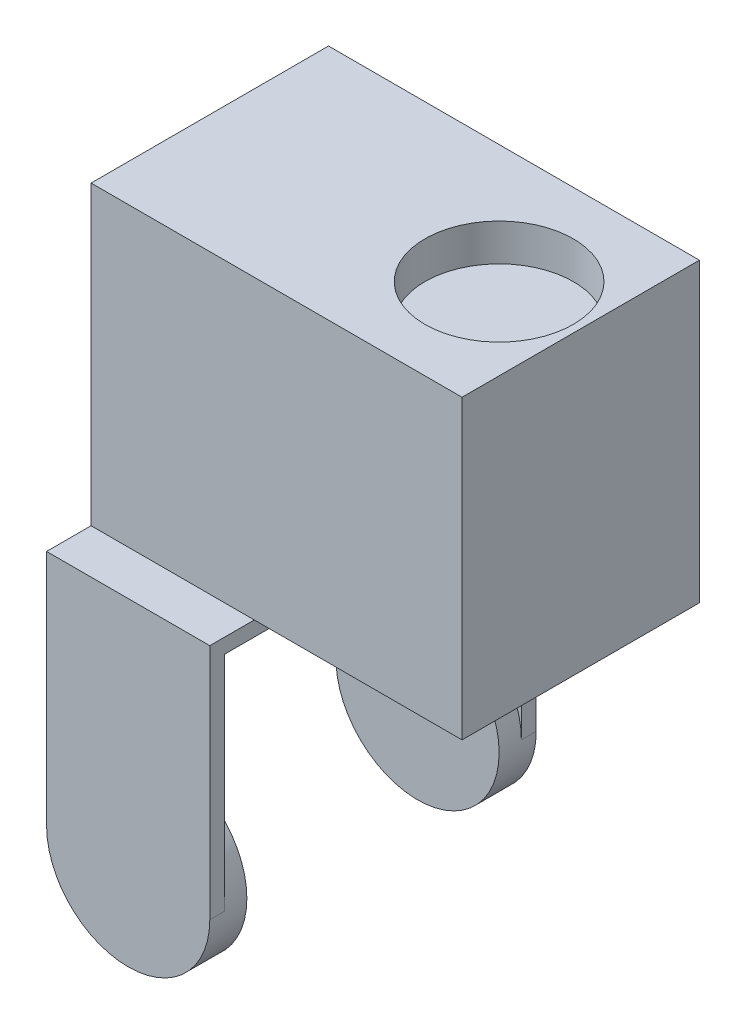
from build123d import *

# Parameters (mm, degrees)
BOSS_EXTRUDE1_DEPTH = 32
BOSS_EXTRUDE2_DEPTH = 38
BOSS_EXTRUDE3_START = 6
BOSS_EXTRUDE3_DEPTH = 6
SKETCH2_W           = 40
SKETCH2_H           = 41
CUT_EXTRUDE1_DEPTH  = 22
SKETCH3_R           = 11
BOSS_EXTRUDE5_DEPTH = 3
BOSS_EXTRUDE6_START = 3
SKETCH4_R           = 11
BOSS_EXTRUDE6_DEPTH = 3
SKETCH13_R          = 10
CUT_EXTRUDE2_DEPTH  = 5


with BuildPart() as part:
    # Sketch1 → Boss-Extrude1 (new body)
    with BuildSketch(Plane.XY):
        Polygon((25, 20), (-25, 20), (-25, -20), (-3, -20), (25, -20), align=None)
    extrude(amount=-BOSS_EXTRUDE1_DEPTH)

    # Sketch1<3> → Boss-Extrude2 (add)
    with BuildSketch(Plane.XY):
        with BuildLine():
            Line((-3, -20), (-25, -20))
            Line((-25, -20), (-25, -52))
            ThreePointArc((-25, -52), (-14, -63), (-3, -52))
            Line((-3, -52), (-3, -20))
        make_face()
    extrude(amount=-BOSS_EXTRUDE2_DEPTH)

    # Sketch1<4> → Boss-Extrude3 (add)
    with BuildSketch(Plane.XY.offset(BOSS_EXTRUDE3_START)):
        with BuildLine():
            Line((-3, -20), (-25, -20))
            Line((-25, -20), (-25, -52))
            ThreePointArc((-25, -52), (-14, -63), (-3, -52))
            Line((-3, -52), (-3, -20))
        make_face()
    extrude(amount=-BOSS_EXTRUDE3_DEPTH)

    # Sketch2 → Cut-Extrude1 (cut)
    with BuildSketch(Plane.ZY.offset(25)):
        with Locations((-16, -42.5)):
            Rectangle(SKETCH2_W, SKETCH2_H)
    extrude(amount=-CUT_EXTRUDE1_DEPTH, mode=Mode.SUBTRACT)

    # Sketch3 → Boss-Extrude5 (add)
    with BuildSketch(Plane(origin=(0, 0, 4), x_dir=(-1, 0, 0), z_dir=(0, 0, -1))):
        with Locations((14, -52)):
            Circle(SKETCH3_R)
    extrude(amount=BOSS_EXTRUDE5_DEPTH)

    # Sketch4 → Boss-Extrude6 (add)
    with BuildSketch(Plane.XY.offset(-36).offset(BOSS_EXTRUDE6_START)):
        with Locations((-14, -52)):
            Circle(SKETCH4_R)
    extrude(amount=-BOSS_EXTRUDE6_DEPTH)

    # Sketch13 → Cut-Extrude2 (cut)
    with BuildSketch(Plane(origin=(0, 20, 0), x_dir=(1, 0, 0), z_dir=(0, 1, 0))):
        with Locations((14, 16)):
            Circle(SKETCH13_R)
    extrude(amount=-CUT_EXTRUDE2_DEPTH, mode=Mode.SUBTRACT)


solid = part.part
